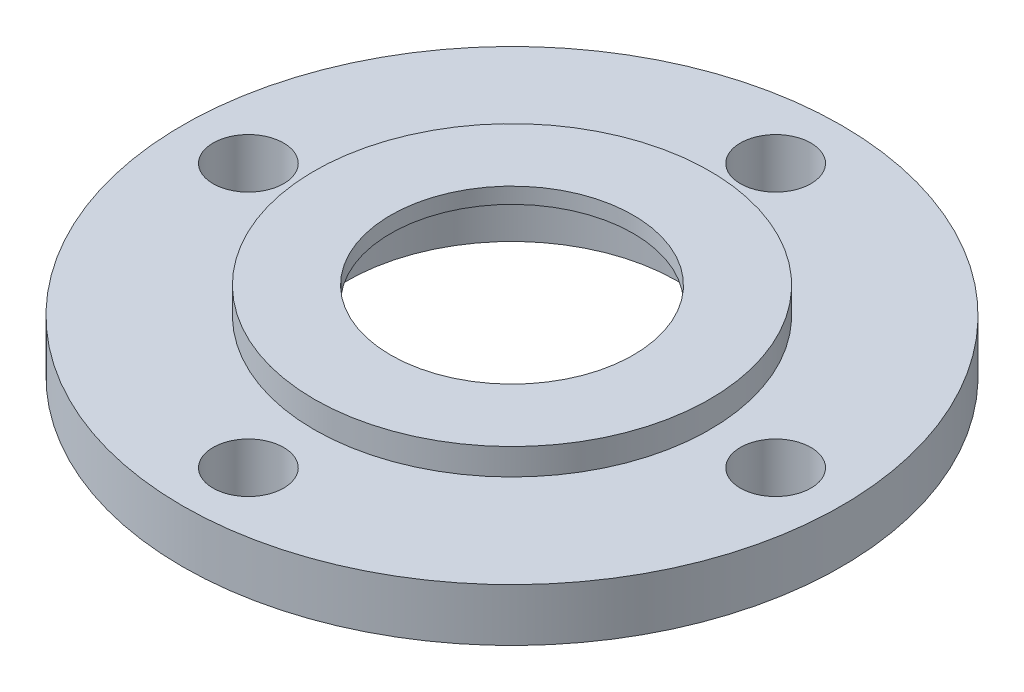
from build123d import *

# Parameters (mm, degrees)
SKETCH1_R           = 15.875
BOSS_EXTRUDE1_DEPTH = 2.54
SKETCH2_R           = 9.525
BOSS_EXTRUDE2_DEPTH = 1.27
SKETCH3_R           = 7.9629
CUT_EXTRUDE1_DEPTH  = 3.048
CUT_EXTRUDE2_REACH  = 24.772
SKETCH4_R           = 5.842
CUT_EXTRUDE3_REACH  = 24.594
SKETCH5_R           = 1.7


with BuildPart() as part:
    # Sketch1 → Boss-Extrude1 (new body)
    with BuildSketch(Plane(origin=(0, 0, 0), x_dir=(1, 0, 0), z_dir=(0, 1, 0))):
        with Locations(Location((0, 0, 0), (0, 0, 270))):
            Circle(SKETCH1_R)
    extrude(amount=BOSS_EXTRUDE1_DEPTH)

    # Sketch2 → Boss-Extrude2 (add)
    with BuildSketch(Plane(origin=(0, 2.54, 0), x_dir=(1, 0, 0), z_dir=(0, 1, 0))):
        with Locations(Location((0, 0, 0), (0, 0, 270))):
            Circle(SKETCH2_R)
    extrude(amount=BOSS_EXTRUDE2_DEPTH)

    # Sketch3 → Cut-Extrude1 (cut)
    with BuildSketch(Plane.XZ):
        with Locations(Location((0, 0, 0), (0, 0, 270))):
            Circle(SKETCH3_R)
    extrude(amount=-CUT_EXTRUDE1_DEPTH, mode=Mode.SUBTRACT)

    # Sketch4 → Cut-Extrude2 (cut, up to next)
    with BuildSketch(Plane(origin=(0, 3.81, 0), x_dir=(1, 0, 0), z_dir=(0, 1, 0)), mode=Mode.PRIVATE) as cut_extrude2_sk1:
        with Locations(Location((0, 0, 0), (0, 0, 270))):
            Circle(SKETCH4_R)
    cut_extrude2_tool1 = extrude(cut_extrude2_sk1.sketch, amount=-CUT_EXTRUDE2_REACH, mode=Mode.PRIVATE) & part.part
    add(cut_extrude2_tool1.solids().sort_by_distance((0, 3.81, 0))[0], mode=Mode.SUBTRACT)

    # Sketch5 → Cut-Extrude3 (cut, up to next)
    with BuildSketch(Plane(origin=(0, 2.54, 0), x_dir=(1, 0, 0), z_dir=(0, 1, 0)), mode=Mode.PRIVATE) as cut_extrude3_sk1:
        with Locations(Location((0, 12.7, 0), (0, 0, 270))):
            Circle(SKETCH5_R)
    cut_extrude3_tool1 = extrude(cut_extrude3_sk1.sketch, amount=-CUT_EXTRUDE3_REACH, mode=Mode.PRIVATE) & part.part
    # Sketch5 → Cut-Extrude3 (cut, up to next)
    with BuildSketch(Plane(origin=(0, 2.54, 0), x_dir=(1, 0, 0), z_dir=(0, 1, 0)), mode=Mode.PRIVATE) as cut_extrude3_sk2:
        with Locations(Location((12.7, 0, 0), (0, 0, 270))):
            Circle(SKETCH5_R)
    cut_extrude3_tool2 = extrude(cut_extrude3_sk2.sketch, amount=-CUT_EXTRUDE3_REACH, mode=Mode.PRIVATE) & part.part
    # Sketch5 → Cut-Extrude3 (cut, up to next)
    with BuildSketch(Plane(origin=(0, 2.54, 0), x_dir=(1, 0, 0), z_dir=(0, 1, 0)), mode=Mode.PRIVATE) as cut_extrude3_sk3:
        with Locations(Location((0, -12.7, 0), (0, 0, 270))):
            Circle(SKETCH5_R)
    cut_extrude3_tool3 = extrude(cut_extrude3_sk3.sketch, amount=-CUT_EXTRUDE3_REACH, mode=Mode.PRIVATE) & part.part
    # Sketch5 → Cut-Extrude3 (cut, up to next)
    with BuildSketch(Plane(origin=(0, 2.54, 0), x_dir=(1, 0, 0), z_dir=(0, 1, 0)), mode=Mode.PRIVATE) as cut_extrude3_sk4:
        with Locations(Location((-12.7, 0, 0), (0, 0, 270))):
            Circle(SKETCH5_R)
    cut_extrude3_tool4 = extrude(cut_extrude3_sk4.sketch, amount=-CUT_EXTRUDE3_REACH, mode=Mode.PRIVATE) & part.part
    add(cut_extrude3_tool1.solids().sort_by_distance((0, 2.54, -12.7))[0], mode=Mode.SUBTRACT)
    add(cut_extrude3_tool2.solids().sort_by_distance((12.7, 2.54, 0))[0], mode=Mode.SUBTRACT)
    add(cut_extrude3_tool3.solids().sort_by_distance((0, 2.54, 12.7))[0], mode=Mode.SUBTRACT)
    add(cut_extrude3_tool4.solids().sort_by_distance((-12.7, 2.54, 0))[0], mode=Mode.SUBTRACT)


solid = part.part
